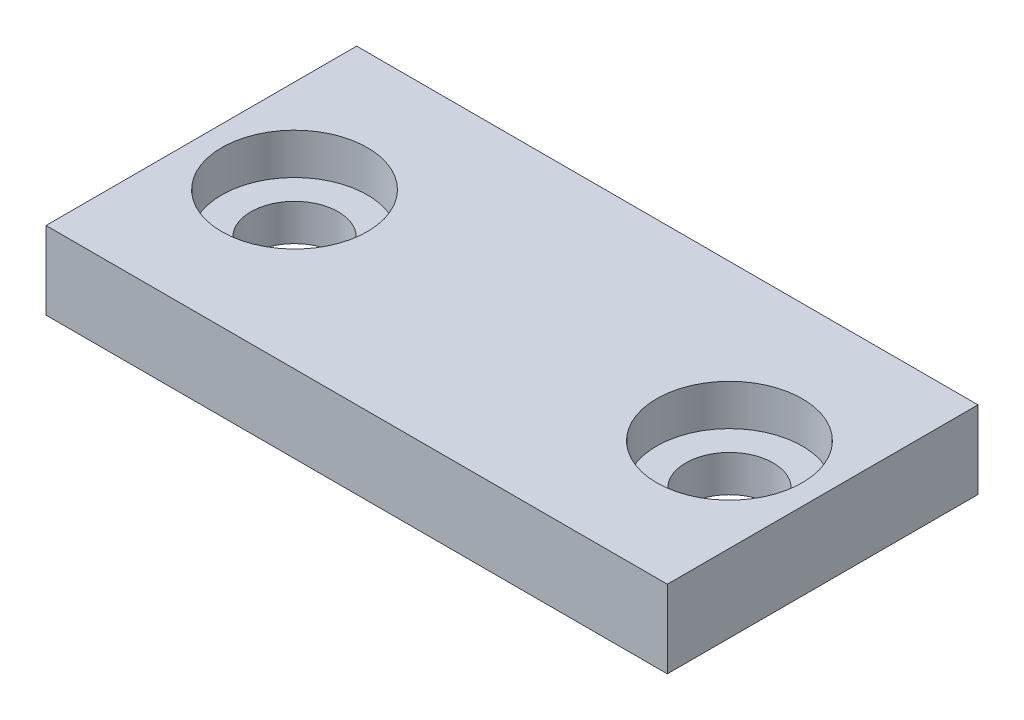
from build123d import *

# Parameters (mm, degrees)
SKETCH1_W                                        = 50.8
SKETCH1_H                                        = 25.4
BOSS_EXTRUDE1_DEPTH                              = 6.35
CBORE_FOR_1_4_BUTTON_HEAD_CAP_SCREW1_D           = 7.14248
CBORE_FOR_1_4_BUTTON_HEAD_CAP_SCREW1_CBORE_D     = 11.90752
CBORE_FOR_1_4_BUTTON_HEAD_CAP_SCREW1_CBORE_DEPTH = 3.3528


with BuildPart() as part:
    # Sketch1 → Boss-Extrude1 (new body)
    with BuildSketch(Plane(origin=(0, 0, 0), x_dir=(1, 0, 0), z_dir=(0, 1, 0))):
        with Locations((25.4, 12.7)):
            Rectangle(SKETCH1_W, SKETCH1_H)
    extrude(amount=BOSS_EXTRUDE1_DEPTH)

    # CBORE for 1/4 Button Head Cap Screw1 (through all)
    with Locations(Plane(origin=(0, 6.35, 0), x_dir=(1, 0, 0), z_dir=(0, 1, 0))):
        with Locations((7.62, 12.7), (43.18, 12.7)):
            CounterBoreHole(CBORE_FOR_1_4_BUTTON_HEAD_CAP_SCREW1_D / 2, CBORE_FOR_1_4_BUTTON_HEAD_CAP_SCREW1_CBORE_D / 2, CBORE_FOR_1_4_BUTTON_HEAD_CAP_SCREW1_CBORE_DEPTH)


solid = part.part
